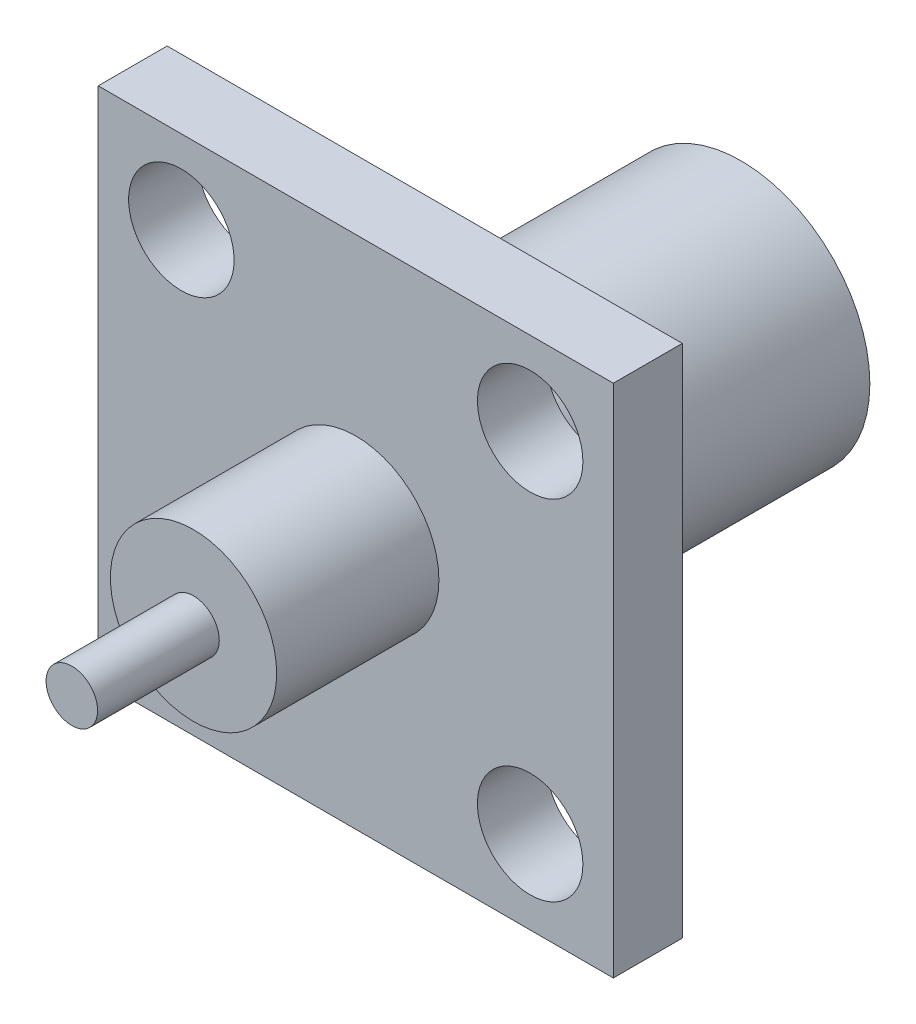
from build123d import *

# Parameters (mm, degrees)
SKETCH_1_W                            = 12.7
SKETCH_1_H                            = 12.7
SKETCH_1_R                            = 1.3
SKETCH_1_R_2                          = 2.05
EXTRUDE_12_7X12_7_1_7_4_2_6_8_6_DEPTH = 1.7
EXTRUDE_START                         = -1.7
SKETCH_2_R                            = 3.175
EXTRUDE_6_35_7_8_DEPTH                = 7.8
SKETCH_3_R                            = 2.05
SKETCH_3_R_2                          = 0.635
EXTRUDE_4_1_4_DEPTH                   = 4
SKETCH_4_R                            = 0.635
EXTRUDE_1_27_3_DEPTH                  = 8.7


with BuildPart() as part:
    # 草图1 → 四孔法兰_12.7x12.7_厚1.7_4孔2.6_8.6孔距 (new body)
    with BuildSketch(Plane.XY):
        Rectangle(SKETCH_1_W, SKETCH_1_H)
        with Locations((-4.3, -4.3)):
            Circle(SKETCH_1_R, mode=Mode.SUBTRACT)
        with Locations((-4.3, 4.3)):
            Circle(SKETCH_1_R, mode=Mode.SUBTRACT)
        with Locations((4.3, -4.3)):
            Circle(SKETCH_1_R, mode=Mode.SUBTRACT)
        with Locations((4.3, 4.3)):
            Circle(SKETCH_1_R, mode=Mode.SUBTRACT)
        Circle(SKETCH_1_R_2, mode=Mode.SUBTRACT)
    extrude(amount=-EXTRUDE_12_7X12_7_1_7_4_2_6_8_6_DEPTH)

    # 草图2 → 前端外形_公称直径6.35_长7.8_未建螺纹牙型 (add)
    with BuildSketch(Plane.XY.offset(EXTRUDE_START)):
        Circle(SKETCH_2_R)
    extrude(amount=-EXTRUDE_6_35_7_8_DEPTH)


with BuildPart() as body_2:
    # 草图3 → 后端绝缘体_直径4.1_伸出4 (new body)
    with BuildSketch(Plane.XY):
        Circle(SKETCH_3_R)
        Circle(SKETCH_3_R_2, mode=Mode.SUBTRACT)
    extrude(amount=EXTRUDE_4_1_4_DEPTH)


with BuildPart() as body_3:
    # 草图4 → 中心导体_直径1.27_露出绝缘体3 (new body)
    with BuildSketch(Plane.XY.offset(EXTRUDE_START)):
        Circle(SKETCH_4_R)
    extrude(amount=EXTRUDE_1_27_3_DEPTH)


solid = Compound([part.part, body_2.part, body_3.part])
